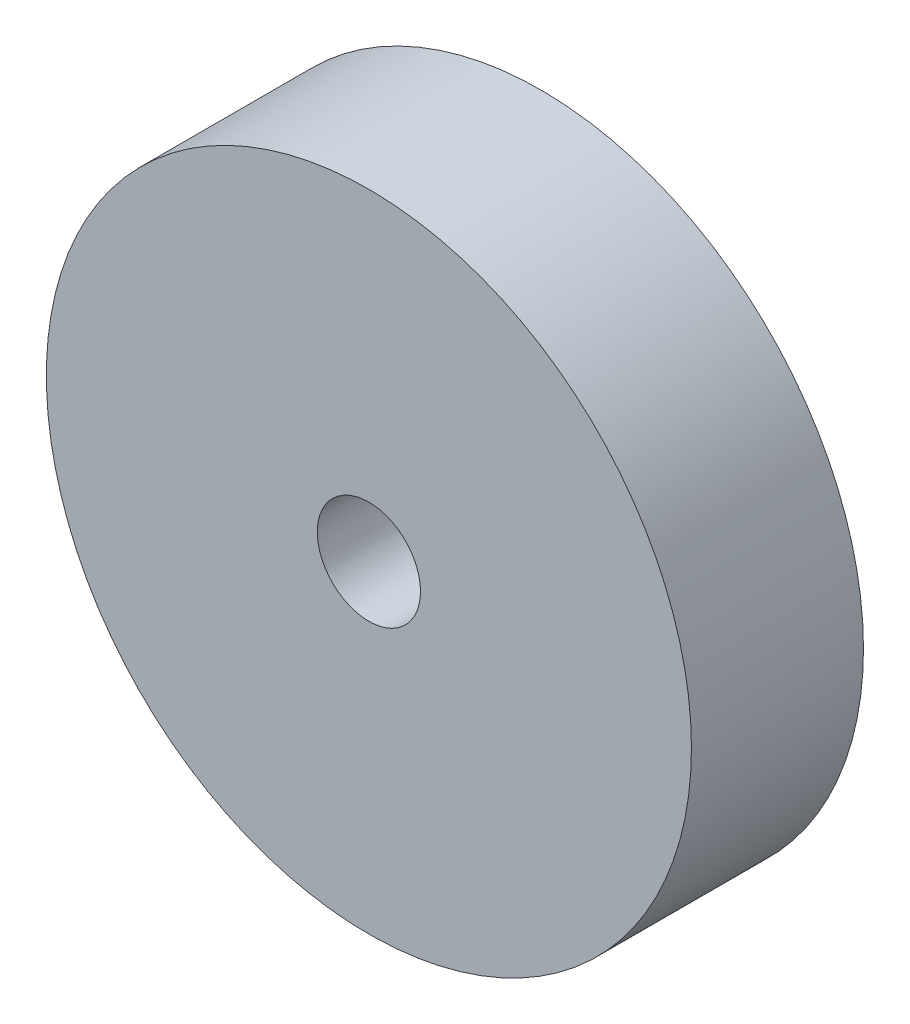
from build123d import *

# Parameters (mm, degrees)
SZKIC1_R                    = 37.5
SZKIC1_R_2                  = 6
DODANIE_WYCI_GNI_CIE1_DEPTH = 10


with BuildPart() as part:
    # Szkic1 → Dodanie-wyciągnięcie1 (new, symmetric)
    with BuildSketch(Plane.XY):
        Circle(SZKIC1_R)
        Circle(SZKIC1_R_2, mode=Mode.SUBTRACT)
    extrude(amount=DODANIE_WYCI_GNI_CIE1_DEPTH, both=True)


solid = part.part
